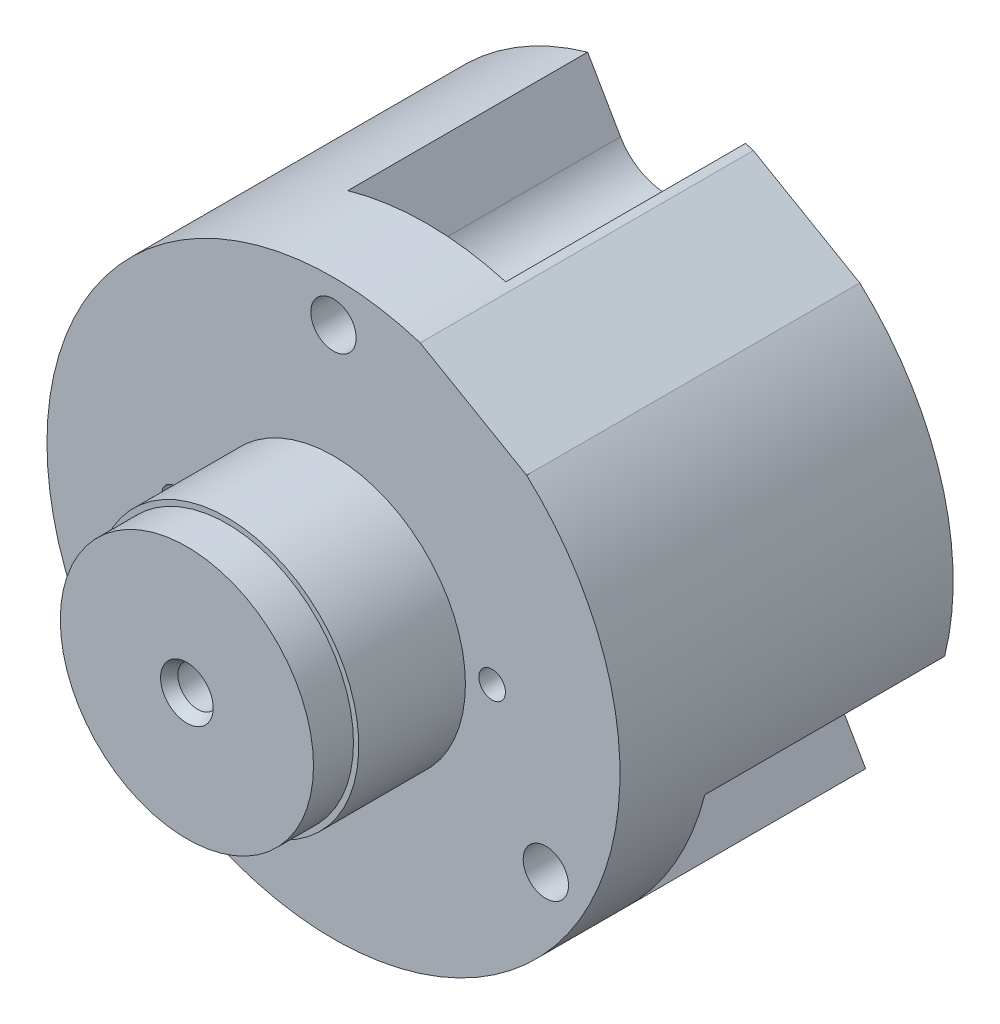
from build123d import *

# Parameters (mm, degrees)
AUFSATZ_LINEAR_AUSTRAGEN1_DEPTH      = 25
SCHNITT_LINEAR_START                 = -18
SCHNITT_LINEAR_AUSTRAGEN1_DEPTH      = 18
SCHNITT_LINEAR_AUSTRAGEN2_DEPTH      = 18
SCHNITT_LINEAR_AUSTRAGEN3_DEPTH      = 18
F_3_4_3_4_DURCHMESSER_BOHRUNG1_D     = 3.4
F_3_4_3_4_DURCHMESSER_BOHRUNG1_DEPTH = 18
F_3_0_3_DURCHMESSER_BOHRUNG2_D       = 3
FASE1_SIZE                           = 0.475
FASE1_SIZE2                          = 0.822724134
M3_GEWINDEBOHRUNG1_D                 = 2.5
M3_GEWINDEBOHRUNG1_DEPTH             = 8.5
M3_GEWINDEBOHRUNG1_TIP               = 0.751075774
F_2_5_2_5_DURCHMESSER_BOHRUNG4_D     = 2.5
F_2_5_2_5_DURCHMESSER_BOHRUNG4_DEPTH = 6
F_2_5_2_5_DURCHMESSER_BOHRUNG4_TIP   = 0.751075774
F_2_0MM_STIFTLOCH1_D                 = 2
F_2_0MM_STIFTLOCH1_DEPTH             = 8.5
F_2_0MM_STIFTLOCH1_TIP               = 0.600860619


with BuildPart() as part:
    # Skizze1 → Aufsatz-Linear austragen1 (new body)
    with BuildSketch(Plane.XY.offset(23)):
        with BuildLine():
            Line((14.492179856, 15.881647365), (6.507820144, 20.491419594))
            ThreePointArc((6.507820144, 20.491419594), (-10.75, -18.619546181), (14.492179856, 15.881647365))
        make_face()
    extrude(amount=-AUFSATZ_LINEAR_AUSTRAGEN1_DEPTH)

    # Skizze2 → Schnitt-Linear austragen1 (cut)
    with BuildSketch(Plane(origin=(0, 0, -2), x_dir=(-1, 0, 0), z_dir=(0, 0, -1)).offset(SCHNITT_LINEAR_START)):
        with BuildLine():
            Line((3.464101615, 16.4), (5.927511586, 20.66675123))
            ThreePointArc((5.927511586, 20.66675123), (0, 21.5), (-5.927511586, 20.66675123))
            Line((-5.927511586, 20.66675123), (-3.464101615, 16.4))
            ThreePointArc((-3.464101615, 16.4), (0, 14.4), (3.464101615, 16.4))
        make_face()
    extrude(amount=SCHNITT_LINEAR_AUSTRAGEN1_DEPTH, mode=Mode.SUBTRACT)

    # Skizze3 → Schnitt-Linear austragen2 (cut)
    with BuildSketch(Plane(origin=(0, 0, -2), x_dir=(-1, 0, 0), z_dir=(0, 0, -1)).offset(SCHNITT_LINEAR_START)):
        with BuildLine():
            Line((12.470765815, -11.2), (14.934175786, -15.46675123))
            ThreePointArc((14.934175786, -15.46675123), (18.619546181, -10.75), (20.861687372, -5.2))
            Line((20.861687372, -5.2), (15.93486743, -5.2))
            ThreePointArc((15.93486743, -5.2), (12.470765815, -7.2), (12.470765815, -11.2))
        make_face()
    extrude(amount=SCHNITT_LINEAR_AUSTRAGEN2_DEPTH, mode=Mode.SUBTRACT)

    # Skizze4 → Schnitt-Linear austragen3 (cut)
    with BuildSketch(Plane(origin=(0, 0, -2), x_dir=(-1, 0, 0), z_dir=(0, 0, -1)).offset(SCHNITT_LINEAR_START)):
        with BuildLine():
            Line((-15.93486743, -5.2), (-20.861687372, -5.2))
            ThreePointArc((-20.861687372, -5.2), (-18.619546181, -10.75), (-14.934175786, -15.46675123))
            Line((-14.934175786, -15.46675123), (-12.470765815, -11.2))
            ThreePointArc((-12.470765815, -11.2), (-12.470765815, -7.2), (-15.93486743, -5.2))
        make_face()
    extrude(amount=SCHNITT_LINEAR_AUSTRAGEN3_DEPTH, mode=Mode.SUBTRACT)

    # Skizze7 → Rotation1 (revolve)
    with BuildSketch(Plane.XZ, mode=Mode.PRIVATE) as rotation1_sk:
        Polygon((9.5, 34), (0, 34), (0, 23), (9.9, 23), (9.9, 31), (9.5, 31), align=None)
    revolve(rotation1_sk.sketch.rotate(Axis((0, 0, 34), (0, 0, -1)), 180), axis=Axis((0, 0, 34), (0, 0, -1)))

    # Ø3.4 (3.4) Durchmesser Bohrung1
    with Locations(Plane(origin=(0, 0, 16), x_dir=(-1, 0, 0), z_dir=(0, 0, -1))):
        with Locations((0, 18.4), (15.93486743, -9.2), (-15.93486743, -9.2)):
            Hole(F_3_4_3_4_DURCHMESSER_BOHRUNG1_D / 2, depth=F_3_4_3_4_DURCHMESSER_BOHRUNG1_DEPTH)

    # Ø3.0 (3) Durchmesser Bohrung2 (through all)
    with Locations(Plane.XY.offset(34)):
        with Locations((0, 0)):
            Hole(F_3_0_3_DURCHMESSER_BOHRUNG2_D / 2)

    # Fase1
    fase1_edges = [part.edges().sort_by_distance(p)[0] for p in [
        (1.5, 0, 34),
    ]]
    fase1_side = [part.faces().sort_by_distance(p)[0] for p in [
        (9.231299423, 0, 34),
    ]]
    chamfer(fase1_edges, length=FASE1_SIZE, length2=FASE1_SIZE2, reference=fase1_side[0])

    # M3 Gewindebohrung1
    with Locations(Plane(origin=(0, 0, -2), x_dir=(-1, 0, 0), z_dir=(0, 0, -1))):
        with Locations((-8.5, 14.722431864), (8.5, -14.722431864)):
            Hole(M3_GEWINDEBOHRUNG1_D / 2, depth=M3_GEWINDEBOHRUNG1_DEPTH)
            with Locations((0, 0, -(M3_GEWINDEBOHRUNG1_DEPTH + M3_GEWINDEBOHRUNG1_TIP / 2))):  # 118° drill point
                Cone(0, M3_GEWINDEBOHRUNG1_D / 2, M3_GEWINDEBOHRUNG1_TIP, mode=Mode.SUBTRACT)

    # Ø2.5 (2.5) Durchmesser Bohrung4
    with Locations(Plane(origin=(0, 0, -2), x_dir=(-1, 0, 0), z_dir=(0, 0, -1))):
        with Locations((-5.549084958, 9.497940228), (5.450915042, -9.554618655)):
            Hole(F_2_5_2_5_DURCHMESSER_BOHRUNG4_D / 2, depth=F_2_5_2_5_DURCHMESSER_BOHRUNG4_DEPTH)
            with Locations((0, 0, -(F_2_5_2_5_DURCHMESSER_BOHRUNG4_DEPTH + F_2_5_2_5_DURCHMESSER_BOHRUNG4_TIP / 2))):  # 118° drill point
                Cone(0, F_2_5_2_5_DURCHMESSER_BOHRUNG4_D / 2, F_2_5_2_5_DURCHMESSER_BOHRUNG4_TIP, mode=Mode.SUBTRACT)

    # Ø2.0mm Stiftloch1
    with Locations(Plane.XY.offset(23)):
        with Locations((-11.887048957, 0.988972746), (11.903074361, 0.983270441)):
            Hole(F_2_0MM_STIFTLOCH1_D / 2, depth=F_2_0MM_STIFTLOCH1_DEPTH)
            with Locations((0, 0, -(F_2_0MM_STIFTLOCH1_DEPTH + F_2_0MM_STIFTLOCH1_TIP / 2))):  # 118° drill point
                Cone(0, F_2_0MM_STIFTLOCH1_D / 2, F_2_0MM_STIFTLOCH1_TIP, mode=Mode.SUBTRACT)


solid = part.part
